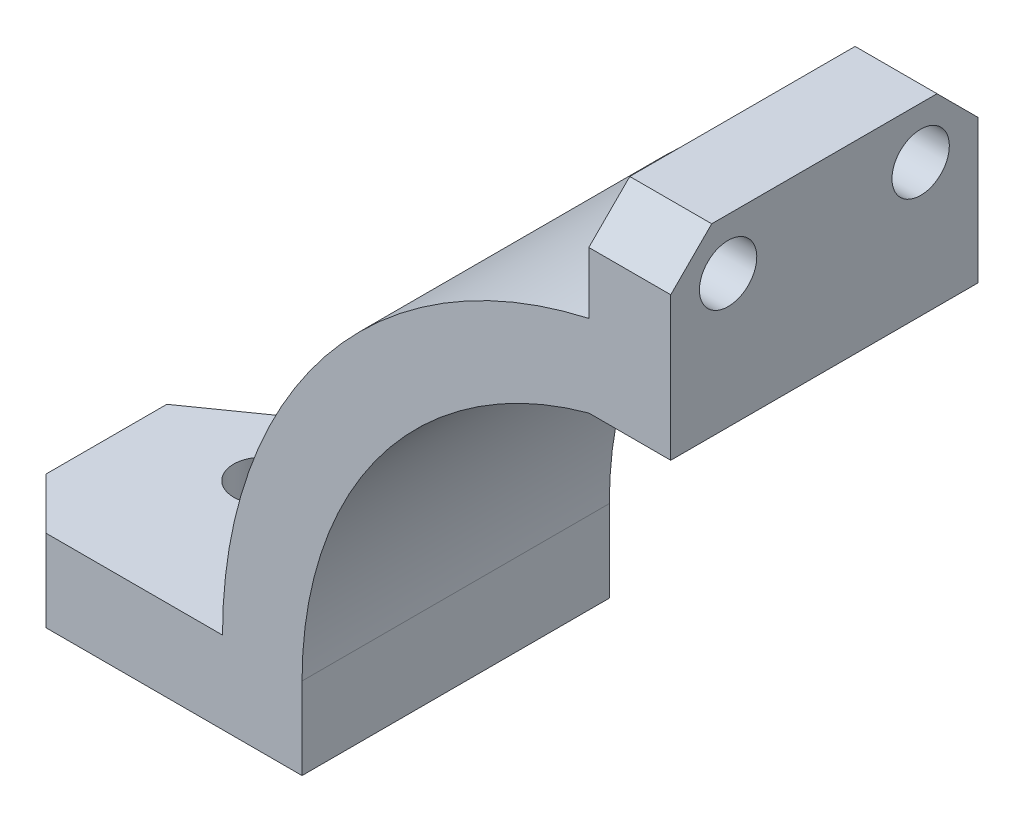
from build123d import *

# Parameters (mm, degrees)
BOSS_EXTRUDE1_DEPTH = 15
CHAMFER1_SIZE       = 2.5
SKETCH2_R           = 1.4
CUT_EXTRUDE1_DEPTH  = 15
CHAMFER2_SIZE       = 2
SKETCH3_R           = 1.4
CUT_EXTRUDE2_DEPTH  = 47.129659115
CUT_EXTRUDE3_DEPTH  = 25


with BuildPart() as part:
    # Sketch1 → Boss-Extrude1 (new body)
    with BuildSketch(Plane.XY):
        with BuildLine():
            Line((-19, 0), (-19, -4))
            Line((-19, -4), (-34, -4))
            Line((-34, -4), (-34, 0))
            Line((-34, 0), (-22.883234523, 0))
            ThreePointArc((-22.883234523, 0), (-17.861391251, 14.304304416), (-5, 22.33030278))
            Line((-5, 22.33030278), (-5, 27.33030278))
            Line((-5, 27.33030278), (-1, 27.33030278))
            Line((-1, 27.33030278), (-1, 18.33030278))
            Line((-1, 18.33030278), (-5, 18.33030278))
            ThreePointArc((-5, 18.33030278), (-15.099668871, 11.532562595), (-19, 0))
        make_face()
    extrude(amount=BOSS_EXTRUDE1_DEPTH)

    # Chamfer1
    chamfer1_edges = [part.edges().sort_by_distance(p)[0] for p in [
        (-34, -2, 0),
        (-34, -2, 15),
    ]]
    chamfer(chamfer1_edges, length=CHAMFER1_SIZE)

    # Sketch2 → Cut-Extrude1 (cut)
    with BuildSketch(Plane.ZY.offset(5)):
        with Locations(Location((2.8, 24.83030278, 0), (0, 0, 270))):
            Circle(SKETCH2_R)
        with Locations(Location((12.2, 24.83030278, 0), (0, 0, 270))):
            Circle(SKETCH2_R)
    extrude(amount=-CUT_EXTRUDE1_DEPTH, mode=Mode.SUBTRACT)

    # Chamfer2
    chamfer2_edges = [part.edges().sort_by_distance(p)[0] for p in [
        (-3, 27.33030278, 0),
        (-3, 27.33030278, 15),
    ]]
    chamfer(chamfer2_edges, length=CHAMFER2_SIZE)

    # Sketch3 → Cut-Extrude2 (cut, through all)
    with BuildSketch(Plane(origin=(0, 0, 0), x_dir=(1, 0, 0), z_dir=(0, 1, 0))):
        with Locations(Location((-28.441617262, -7.5, 0), (0, 0, 270))):
            Circle(SKETCH3_R)
    extrude(amount=-CUT_EXTRUDE2_DEPTH, mode=Mode.SUBTRACT)

    # Sketch4 → Cut-Extrude3 (cut)
    with BuildSketch(Plane.XZ.offset(4)):
        Polygon((-24.636069701, 0), (-34, 6.600391812), (-34, 2.5), (-31.5, 0), align=None)
    extrude(amount=-CUT_EXTRUDE3_DEPTH, mode=Mode.SUBTRACT)


solid = part.part
